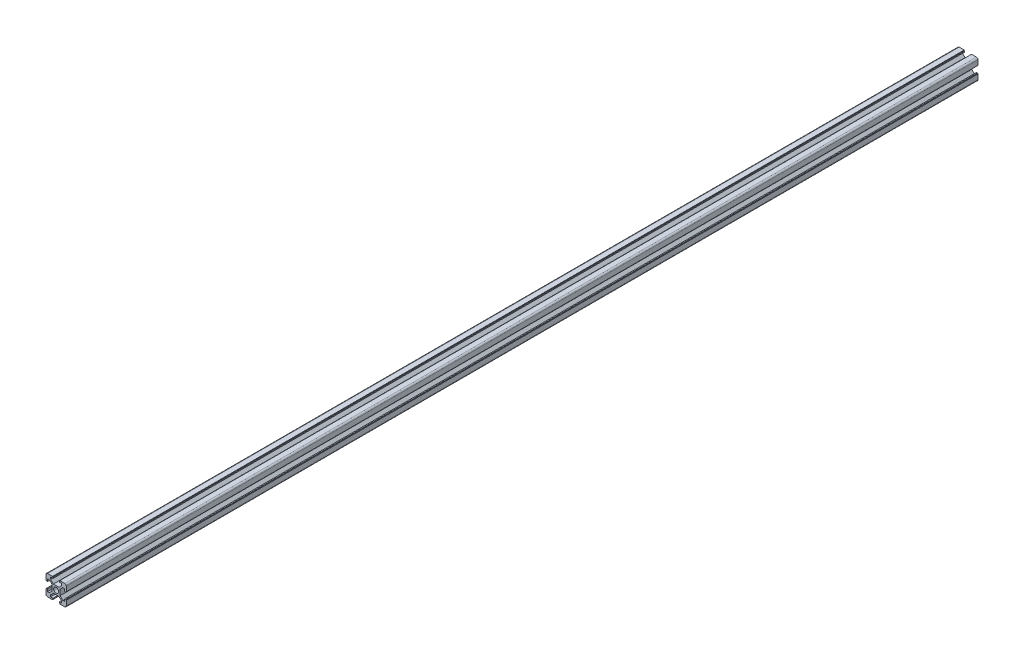
from build123d import *

# Parameters (mm, degrees)
EXTRUDE_1_DEPTH     = 900
SKETCH_6_R          = 2.1
CUT_EXTRUDE_3_DEPTH = 901.162879706
SKETCH_5_R          = 2.1
CUT_EXTRUDE_4_DEPTH = 901.162879806
SKETCH_7_R          = 2.1
CUT_EXTRUDE_5_DEPTH = 901.162879806


with BuildPart() as part:
    # 草图1 → 凸台-拉伸1 (new body)
    with BuildSketch(Plane.XY):
        with BuildLine():
            Line((8.5, 10), (3.6, 10))
            Line((3.6, 10), (3.6, 9.5))
            Line((3.6, 9.5), (3.1, 9.5))
            Line((3.1, 9.5), (3.1, 8.5))
            Line((3.1, 8.5), (5.5, 8.5))
            Line((5.5, 8.5), (5.5, 6.65))
            Line((5.5, 6.65), (2.75, 3.9))
            Line((2.75, 3.9), (-2.75, 3.9))
            Line((-2.75, 3.9), (-5.5, 6.65))
            Line((-5.5, 6.65), (-5.5, 8.5))
            Line((-5.5, 8.5), (-3.1, 8.5))
            Line((-3.1, 8.5), (-3.1, 9.5))
            Line((-3.1, 9.5), (-3.6, 9.5))
            Line((-3.6, 9.5), (-3.6, 10))
            Line((-3.6, 10), (-8.5, 10))
            ThreePointArc((-8.5, 10), (-9.560660172, 9.560660172), (-10, 8.5))
            Line((-10, 8.5), (-10, 3.6))
            Line((-10, 3.6), (-9.5, 3.6))
            Line((-9.5, 3.6), (-9.5, 3.1))
            Line((-9.5, 3.1), (-8.5, 3.1))
            Line((-8.5, 3.1), (-8.5, 5.5))
            Line((-8.5, 5.5), (-6.65, 5.5))
            Line((-6.65, 5.5), (-3.9, 2.75))
            Line((-3.9, 2.75), (-3.9, -2.75))
            Line((-3.9, -2.75), (-6.65, -5.5))
            Line((-6.65, -5.5), (-8.5, -5.5))
            Line((-8.5, -5.5), (-8.5, -3.1))
            Line((-8.5, -3.1), (-9.5, -3.1))
            Line((-9.5, -3.1), (-9.5, -3.6))
            Line((-9.5, -3.6), (-10, -3.6))
            Line((-10, -3.6), (-10, -8.5))
            ThreePointArc((-10, -8.5), (-9.560660172, -9.560660172), (-8.5, -10))
            Line((-8.5, -10), (-3.6, -10))
            Line((-3.6, -10), (-3.6, -9.5))
            Line((-3.6, -9.5), (-3.1, -9.5))
            Line((-3.1, -9.5), (-3.1, -8.5))
            Line((-3.1, -8.5), (-5.5, -8.5))
            Line((-5.5, -8.5), (-5.5, -6.65))
            Line((-5.5, -6.65), (-2.75, -3.9))
            Line((-2.75, -3.9), (2.75, -3.9))
            Line((2.75, -3.9), (5.5, -6.65))
            Line((5.5, -6.65), (5.5, -8.5))
            Line((5.5, -8.5), (3.1, -8.5))
            Line((3.1, -8.5), (3.1, -9.5))
            Line((3.1, -9.5), (3.6, -9.5))
            Line((3.6, -9.5), (3.6, -10))
            Line((3.6, -10), (8.5, -10))
            ThreePointArc((8.5, -10), (9.560660172, -9.560660172), (10, -8.5))
            Line((10, -8.5), (10, -3.6))
            Line((10, -3.6), (9.5, -3.6))
            Line((9.5, -3.6), (9.5, -3.1))
            Line((9.5, -3.1), (8.5, -3.1))
            Line((8.5, -3.1), (8.5, -5.5))
            Line((8.5, -5.5), (6.65, -5.5))
            Line((6.65, -5.5), (3.9, -2.75))
            Line((3.9, -2.75), (3.9, 2.75))
            Line((3.9, 2.75), (6.65, 5.5))
            Line((6.65, 5.5), (8.5, 5.5))
            Line((8.5, 5.5), (8.5, 3.1))
            Line((8.5, 3.1), (9.5, 3.1))
            Line((9.5, 3.1), (9.5, 3.6))
            Line((9.5, 3.6), (10, 3.6))
            Line((10, 3.6), (10, 8.5))
            ThreePointArc((10, 8.5), (9.560660172, 9.560660172), (8.5, 10))
        make_face()
        with BuildLine():
            ThreePointArc((-2.5, 0), (0, -2.5), (2.5, 0))
            ThreePointArc((2.5, 0), (0, 2.5), (-2.5, 0))
        make_face(mode=Mode.SUBTRACT)
    extrude(amount=EXTRUDE_1_DEPTH)

    # 草图6 → 切除-拉伸3 (cut, through all)
    with BuildSketch(Plane(origin=(0, 3.9, 0), x_dir=(1, 0, 0), z_dir=(0, 1, 0))):
        with Locations(Location((0, -590, 0), (0, 0, 180))):
            Circle(SKETCH_6_R)
    extrude(amount=-CUT_EXTRUDE_3_DEPTH, mode=Mode.SUBTRACT)

    # 草图5 → 切除-拉伸4 (cut, through all)
    with BuildSketch(Plane(origin=(0, 3.9, 0), x_dir=(1, 0, 0), z_dir=(0, 1, 0))):
        with Locations(Location((0, -720, 0), (0, 0, 180))):
            Circle(SKETCH_5_R)
    extrude(amount=-CUT_EXTRUDE_4_DEPTH, mode=Mode.SUBTRACT)

    # 草图7 → 切除-拉伸5 (cut, through all)
    with BuildSketch(Plane(origin=(0, 3.9, 0), x_dir=(1, 0, 0), z_dir=(0, 1, 0))):
        with Locations(Location((0, -300, 0), (0, 0, 180))):
            Circle(SKETCH_7_R)
        with Locations(Location((0, -100, 0), (0, 0, 180))):
            Circle(SKETCH_7_R)
    extrude(amount=-CUT_EXTRUDE_5_DEPTH, mode=Mode.SUBTRACT)


solid = part.part
